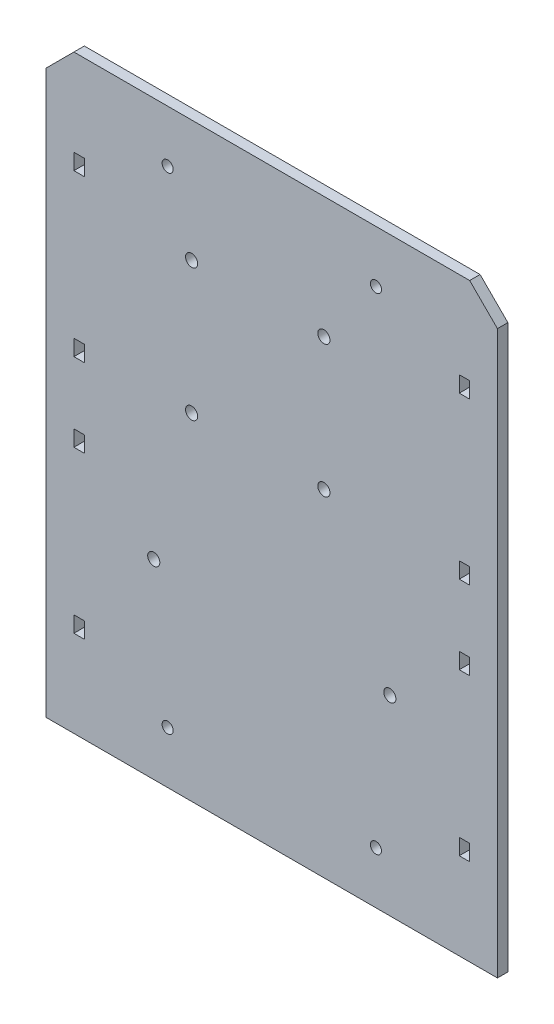
from build123d import *

# Parameters (mm, degrees)
SKETCH_1_R      = 1.6
SKETCH_1_R_2    = 1.75
SKETCH_1_W      = 3
SKETCH_1_H      = 4.6
EXTRUDE_1_DEPTH = 3


with BuildPart() as part:
    # ｽｹｯﾁ1 → ﾎﾞｽ - 押し出し1 (new body)
    with BuildSketch(Plane.XY):
        Polygon((0, 162), (8, 170), (122, 170), (130, 162), (130, 0), (0, 0), align=None)
        with Locations((35, 155)):
            Circle(SKETCH_1_R, mode=Mode.SUBTRACT)
        with Locations((95, 155)):
            Circle(SKETCH_1_R, mode=Mode.SUBTRACT)
        with Locations((35, 15)):
            Circle(SKETCH_1_R, mode=Mode.SUBTRACT)
        with Locations((95, 15)):
            Circle(SKETCH_1_R, mode=Mode.SUBTRACT)
        with Locations((41.9, 135)):
            Circle(SKETCH_1_R_2, mode=Mode.SUBTRACT)
        with Locations((80, 135)):
            Circle(SKETCH_1_R_2, mode=Mode.SUBTRACT)
        with Locations((41.9, 96.9)):
            Circle(SKETCH_1_R_2, mode=Mode.SUBTRACT)
        with Locations((80, 96.9)):
            Circle(SKETCH_1_R_2, mode=Mode.SUBTRACT)
        with Locations((31, 55)):
            Circle(SKETCH_1_R_2, mode=Mode.SUBTRACT)
        with Locations((99, 55)):
            Circle(SKETCH_1_R_2, mode=Mode.SUBTRACT)
        with Locations((9.5, 142.7)):
            Rectangle(SKETCH_1_W, SKETCH_1_H, mode=Mode.SUBTRACT)
        with Locations((120.5, 142.7)):
            Rectangle(SKETCH_1_W, SKETCH_1_H, mode=Mode.SUBTRACT)
        with Locations((9.5, 27.3)):
            Rectangle(SKETCH_1_W, SKETCH_1_H, mode=Mode.SUBTRACT)
        with Locations((120.5, 27.3)):
            Rectangle(SKETCH_1_W, SKETCH_1_H, mode=Mode.SUBTRACT)
        with Locations((9.5, 96.3)):
            Rectangle(SKETCH_1_W, SKETCH_1_H, mode=Mode.SUBTRACT)
        with Locations((120.5, 96.3)):
            Rectangle(SKETCH_1_W, SKETCH_1_H, mode=Mode.SUBTRACT)
        with Locations((9.5, 73.7)):
            Rectangle(SKETCH_1_W, SKETCH_1_H, mode=Mode.SUBTRACT)
        with Locations((120.5, 73.7)):
            Rectangle(SKETCH_1_W, SKETCH_1_H, mode=Mode.SUBTRACT)
    extrude(amount=EXTRUDE_1_DEPTH)


solid = part.part
